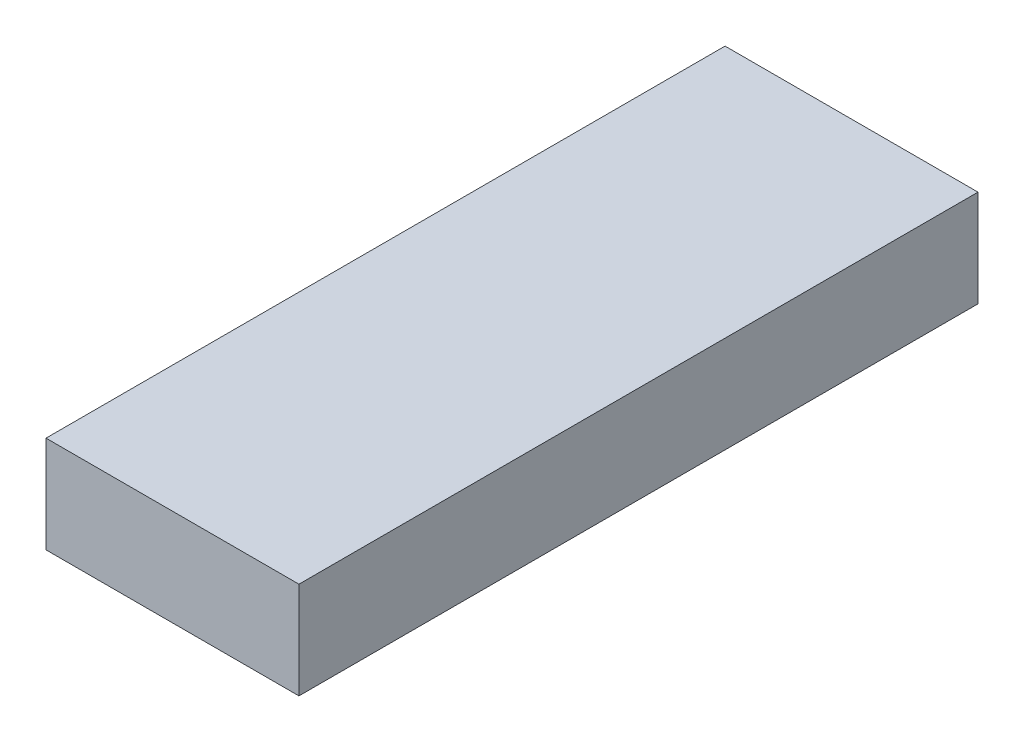
from build123d import *

# Parameters (mm, degrees)
SKETCH1_W      = 37.846
SKETCH1_H      = 101.6
EXTRUDE1_DEPTH = 14.478


with BuildPart() as part:
    # Sketch1 → Extrude1 (new body)
    with BuildSketch(Plane(origin=(0, 0, 0), x_dir=(1, 0, 0), z_dir=(0, 1, 0))):
        with Locations((-18.040835045, -31.212326728)):
            Rectangle(SKETCH1_W, SKETCH1_H)
    extrude(amount=EXTRUDE1_DEPTH)


solid = part.part
